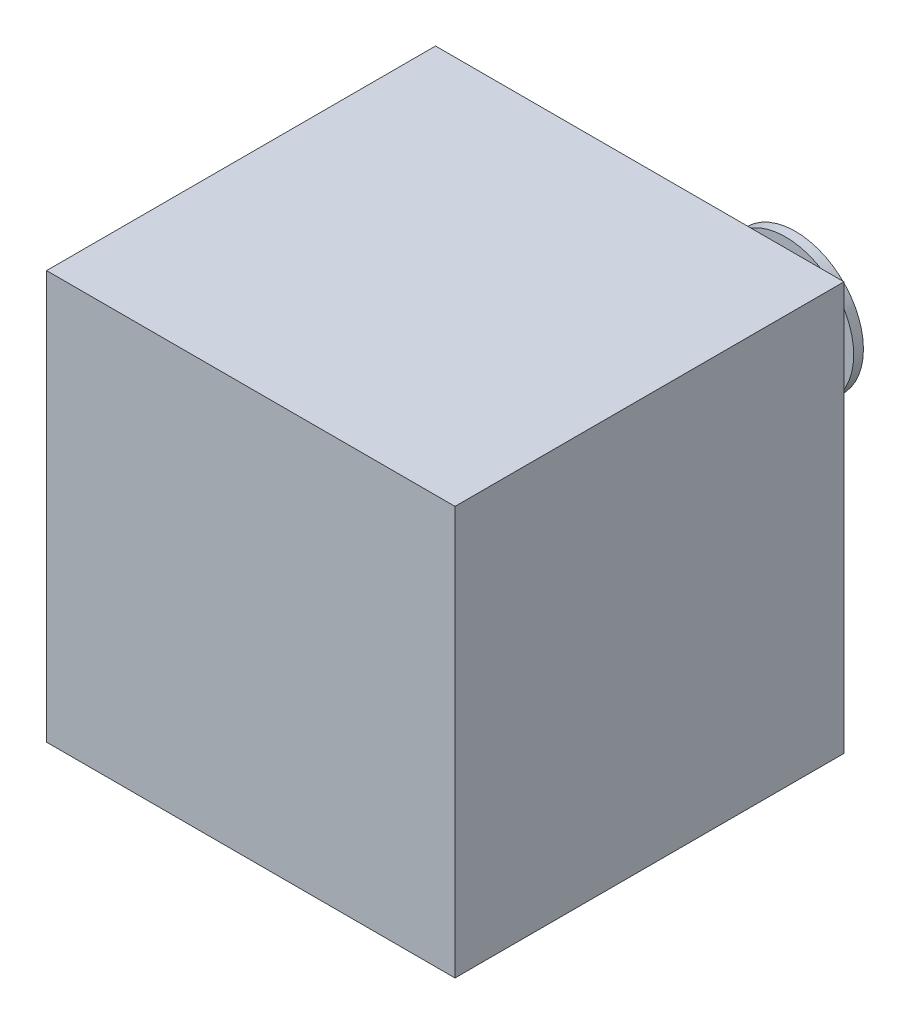
from build123d import *

# Parameters (mm, degrees)
SKETCH_1_W      = 42
SKETCH_1_H      = 42
EXTRUDE_1_DEPTH = 40
SKETCH_1_3_R    = 11.5
EXTRUDE_2_DEPTH = 2
SKETCH_1_4_R    = 2.5
EXTRUDE_3_DEPTH = 16


with BuildPart() as part:
    # 草图1 → 凸台-拉伸1 (new body)
    with BuildSketch(Plane.XY):
        Rectangle(SKETCH_1_W, SKETCH_1_H)
    extrude(amount=EXTRUDE_1_DEPTH)

    # 草图1<3> → 凸台-拉伸2 (add)
    with BuildSketch(Plane.XY):
        Circle(SKETCH_1_3_R)
    extrude(amount=-EXTRUDE_2_DEPTH)

    # 草图1<4> → 凸台-拉伸3 (add)
    with BuildSketch(Plane.XY):
        Circle(SKETCH_1_4_R)
    extrude(amount=-EXTRUDE_3_DEPTH)

    # 草图2 → 旋转1 (revolve)
    with BuildSketch(Plane(origin=(0, 0, 0), x_dir=(1, 0, 0), z_dir=(0, 1, 0))):
        Polygon((2.5, 16), (7, 16), (7, 15), (6, 15), (6, 9), (7, 9), (7, 8), (2.5, 8), align=None)
    revolve(axis=Axis((0, 0, 1000), (0, 0, -1)))


solid = part.part
